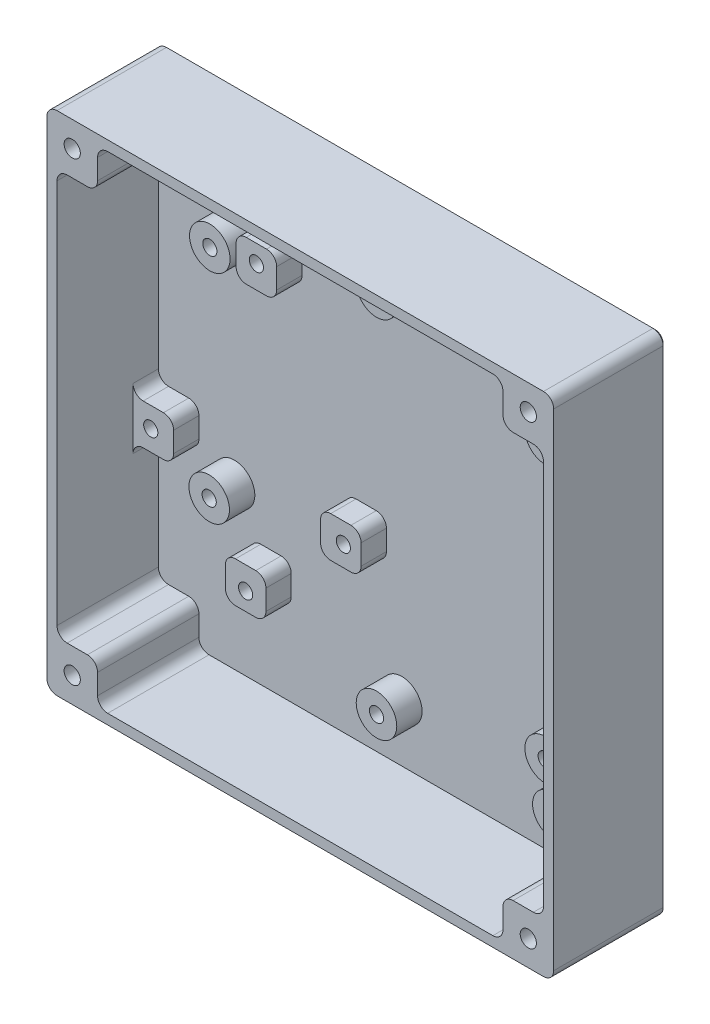
from build123d import *

# Parameters (mm, degrees)
SKETCH_1_W          = 100
SKETCH_1_H          = 100
EXTRUDE_1_DEPTH     = 2
SKETCH_2_W          = 100
SKETCH_2_H          = 100
SKETCH_2_W_2        = 96
SKETCH_2_H_2        = 96
EXTRUDE_2_DEPTH     = 20
SKETCH_3_W          = 8
SKETCH_3_H          = 8
EXTRUDE_3_DEPTH     = 20
SKETCH_4_R          = 1.6
CUT_EXTRUDE_1_DEPTH = 144.122325303
SKETCH_5_R          = 3.05
CUT_EXTRUDE_2_DEPTH = 15
SKETCH_6_R          = 4
EXTRUDE_4_DEPTH     = 5
SKETCH_7_R          = 1.4
CUT_EXTRUDE_3_DEPTH = 6
SKETCH_8_R          = 4
EXTRUDE_5_DEPTH     = 5
SKETCH_9_R          = 1.4
CUT_EXTRUDE_4_DEPTH = 6
SKETCH_10_W         = 8
SKETCH_10_H         = 8
EXTRUDE_6_DEPTH     = 5
SKETCH_11_R         = 1.4
CUT_EXTRUDE_5_DEPTH = 5
FILLET_1_R          = 2
FILLET_2_R          = 2
CHAMFER_1_SIZE      = 0.4


with BuildPart() as part:
    # 草图1 → 凸台-拉伸1 (new body)
    with BuildSketch(Plane.XY):
        with Locations((50, 50)):
            Rectangle(SKETCH_1_W, SKETCH_1_H)
    extrude(amount=EXTRUDE_1_DEPTH)

    # 草图2 → 凸台-拉伸2 (add)
    with BuildSketch(Plane.XY.offset(2)):
        with Locations((50, 50)):
            Rectangle(SKETCH_2_W, SKETCH_2_H)
        with Locations((50, 50)):
            Rectangle(SKETCH_2_W_2, SKETCH_2_H_2, mode=Mode.SUBTRACT)
    extrude(amount=EXTRUDE_2_DEPTH)

    # 草图3 → 凸台-拉伸3 (add)
    with BuildSketch(Plane.XY.offset(22)):
        with Locations((94, 94)):
            Rectangle(SKETCH_3_W, SKETCH_3_H)
        with Locations((6, 94)):
            Rectangle(SKETCH_3_W, SKETCH_3_H)
        with Locations((6, 6)):
            Rectangle(SKETCH_3_W, SKETCH_3_H)
        with Locations((94, 6)):
            Rectangle(SKETCH_3_W, SKETCH_3_H)
    extrude(amount=-EXTRUDE_3_DEPTH)

    # 草图4 → 切除-拉伸1 (cut, through all)
    with BuildSketch(Plane.XY.offset(22)):
        with Locations((5, 95)):
            Circle(SKETCH_4_R)
        with Locations((95, 95)):
            Circle(SKETCH_4_R)
        with Locations((95, 5)):
            Circle(SKETCH_4_R)
        with Locations((5, 5)):
            Circle(SKETCH_4_R)
    extrude(amount=-CUT_EXTRUDE_1_DEPTH, mode=Mode.SUBTRACT)

    # 草图5 → 切除-拉伸2 (cut)
    with BuildSketch(Plane(origin=(0, 0, 0), x_dir=(-1, 0, 0), z_dir=(0, 0, -1))):
        with Locations((-95, 5)):
            Circle(SKETCH_5_R)
        with Locations((-5, 5)):
            Circle(SKETCH_5_R)
        with Locations((-5, 95)):
            Circle(SKETCH_5_R)
        with Locations((-95, 95)):
            Circle(SKETCH_5_R)
    extrude(amount=-CUT_EXTRUDE_2_DEPTH, mode=Mode.SUBTRACT)

    # 草图6 → 凸台-拉伸4 (add)
    with BuildSketch(Plane.XY.offset(2)):
        with Locations(Location((50.039624079, 85.202692405, 0), (0, 0, 180))):
            Circle(SKETCH_6_R)
        with Locations(Location((84.710693421, 85.710693421, 0), (0, 0, 180))):
            Circle(SKETCH_6_R)
        with Locations(Location((84.837693675, 13.447548895, 0), (0, 0, 180))):
            Circle(SKETCH_6_R)
        with Locations(Location((50.039624079, 13.320548641, 0), (0, 0, 180))):
            Circle(SKETCH_6_R)
    extrude(amount=EXTRUDE_4_DEPTH)

    # 草图7 → 切除-拉伸3 (cut)
    with BuildSketch(Plane.XY.offset(7)):
        with Locations((50.039624079, 85.202692405)):
            Circle(SKETCH_7_R)
        with Locations((84.710693421, 85.710693421)):
            Circle(SKETCH_7_R)
        with Locations((84.837693675, 13.447548895)):
            Circle(SKETCH_7_R)
        with Locations((50.039624079, 13.320548641)):
            Circle(SKETCH_7_R)
    extrude(amount=-CUT_EXTRUDE_3_DEPTH, mode=Mode.SUBTRACT)

    # 草图8 → 凸台-拉伸5 (add)
    with BuildSketch(Plane.XY.offset(2)):
        with Locations(Location((17.154559309, 76.694691389, 0), (0, 0, 180))):
            Circle(SKETCH_8_R)
        with Locations(Location((83.321691643, 76.694691389, 0), (0, 0, 180))):
            Circle(SKETCH_8_R)
        with Locations(Location((83.321691643, 22.211582423, 0), (0, 0, 180))):
            Circle(SKETCH_8_R)
        with Locations(Location((17.027559055, 33.768605537, 0), (0, 0, 180))):
            Circle(SKETCH_8_R)
    extrude(amount=EXTRUDE_5_DEPTH)

    # 草图9 → 切除-拉伸4 (cut)
    with BuildSketch(Plane.XY.offset(7)):
        with Locations((17.154559309, 76.694691389)):
            Circle(SKETCH_9_R)
        with Locations((83.321691643, 76.694691389)):
            Circle(SKETCH_9_R)
        with Locations((83.321691643, 22.211582423)):
            Circle(SKETCH_9_R)
        with Locations((17.027559055, 33.768605537)):
            Circle(SKETCH_9_R)
    extrude(amount=-CUT_EXTRUDE_4_DEPTH, mode=Mode.SUBTRACT)

    # 草图10 → 凸台-拉伸6 (add)
    with BuildSketch(Plane.XY.offset(2)):
        with Locations((26.340943559, 78)):
            Rectangle(SKETCH_10_W, SKETCH_10_H)
        with Locations((43, 39.128660939)):
            Rectangle(SKETCH_10_W, SKETCH_10_H)
        with Locations((24.216466551, 22)):
            Rectangle(SKETCH_10_W, SKETCH_10_H)
        with Locations((6, 39.871700936)):
            Rectangle(SKETCH_10_W, SKETCH_10_H)
    extrude(amount=EXTRUDE_6_DEPTH)

    # 草图11 → 切除-拉伸5 (cut)
    with BuildSketch(Plane.XY.offset(7)):
        with Locations((26.340943559, 78.5)):
            Circle(SKETCH_11_R)
        with Locations((43.5, 39.128660939)):
            Circle(SKETCH_11_R)
        with Locations((5.5, 39.871700936)):
            Circle(SKETCH_11_R)
        with Locations((24.216466551, 21.5)):
            Circle(SKETCH_11_R)
    extrude(amount=-CUT_EXTRUDE_5_DEPTH, mode=Mode.SUBTRACT)

    # 圆角1
    fillet_1_edges = [part.edges().sort_by_distance(p)[0] for p in [
        (0, 100, 11),
        (100, 100, 11),
        (100, 0, 11),
        (0, 0, 11),
    ]]
    fillet(fillet_1_edges, radius=FILLET_1_R)

    # 圆角2
    fillet_2_edges = [part.edges().sort_by_distance(p)[0] for p in [
        (22.340943559, 82, 4.5),
        (22.340943559, 74, 4.5),
        (30.340943559, 74, 4.5),
        (30.340943559, 82, 4.5),
        (39, 43.128660939, 4.5),
        (39, 35.128660939, 4.5),
        (47, 35.128660939, 4.5),
        (47, 43.128660939, 4.5),
        (20.216466551, 26, 4.5),
        (20.216466551, 18, 4.5),
        (28.216466551, 18, 4.5),
        (28.216466551, 26, 4.5),
        (10, 35.871700936, 4.5),
        (10, 43.871700936, 4.5),
        (2, 43.871700936, 4.5),
        (2, 35.871700936, 4.5),
        (90, 10, 12),
        (90, 2, 12),
        (98, 10, 12),
        (10, 2, 12),
        (10, 10, 12),
        (2, 10, 12),
        (10, 90, 12),
        (10, 98, 12),
        (2, 90, 12),
        (98, 90, 12),
        (90, 98, 12),
        (90, 90, 12),
    ]]
    fillet(fillet_2_edges, radius=FILLET_2_R)

    # 倒角1
    chamfer_1_edges = [part.edges().sort_by_distance(p)[0] for p in [
        (98.05, 95, 0),
        (8.05, 95, 0),
        (8.05, 5, 0),
        (98.05, 5, 0),
        (50, 100, 0),
        (0, 50, 0),
        (100, 50, 0),
        (50, 0, 0),
        (0.585786438, 0.585786438, 0),
        (0.585786438, 99.414213562, 0),
        (99.414213562, 0.585786438, 0),
        (99.414213562, 99.414213562, 0),
    ]]
    chamfer(chamfer_1_edges, length=CHAMFER_1_SIZE)


solid = part.part
